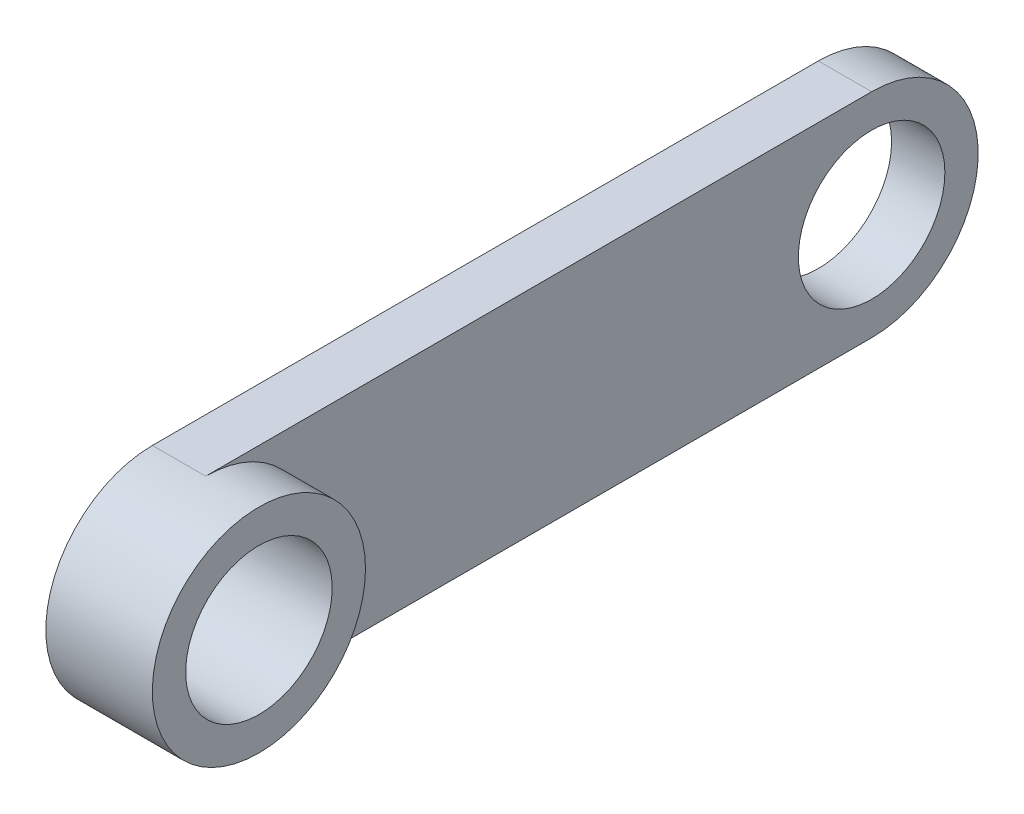
from build123d import *

# Parameters (mm, degrees)
SKETCH1_R           = 2.75
BOSS_EXTRUDE1_DEPTH = 2
SKETCH2_R           = 4
SKETCH2_R_2         = 2.75
BOSS_EXTRUDE2_DEPTH = 4


with BuildPart() as part:
    # Sketch1 → Boss-Extrude1 (new body)
    with BuildSketch(Plane(origin=(0, 0, 0), x_dir=(0, 0, -1), z_dir=(1, 0, 0))):
        with BuildLine():
            Line((4, 0), (29, 0))
            ThreePointArc((29, 0), (33, 4), (29, 8))
            Line((29, 8), (4, 8))
            ThreePointArc((4, 8), (0, 4), (4, 0))
        make_face()
        with Locations((4, 4)):
            Circle(SKETCH1_R, mode=Mode.SUBTRACT)
        with Locations((29, 4)):
            Circle(SKETCH1_R, mode=Mode.SUBTRACT)
    extrude(amount=BOSS_EXTRUDE1_DEPTH)

    # Sketch2 → Boss-Extrude2 (add)
    with BuildSketch(Plane(origin=(0, 0, 0), x_dir=(0, 0, -1), z_dir=(1, 0, 0))):
        with Locations(Location((4, 4, 0), (0, 0, 270))):
            Circle(SKETCH2_R)
        with Locations((4, 4)):
            Circle(SKETCH2_R_2, mode=Mode.SUBTRACT)
    extrude(amount=BOSS_EXTRUDE2_DEPTH)


solid = part.part
